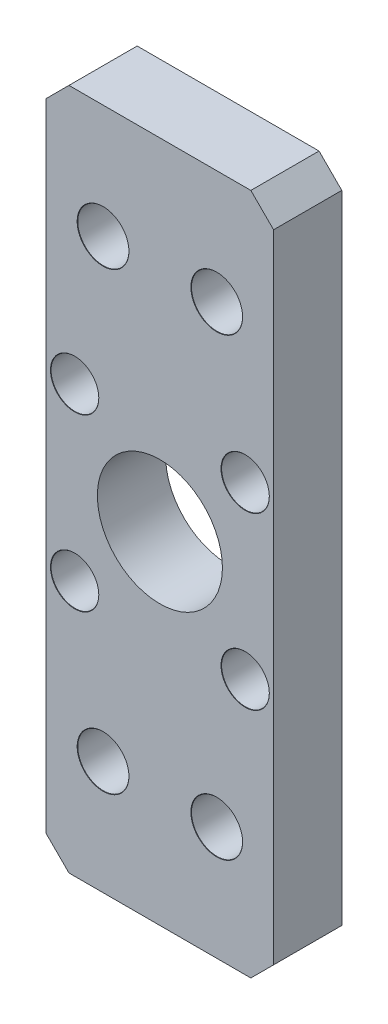
from build123d import *

# Parameters (mm, degrees)
SKETCH_1_W                        = 20
SKETCH_1_H                        = 60
EXTRUDE_1_DEPTH                   = 6
HOLE_WIZARD_4_5_4_5_1_D           = 4.5
HOLE_WIZARD_4_5_4_5_1_CSINK_D     = 4.55
HOLE_WIZARD_4_5_4_5_1_CSINK_ANGLE = 90
SKETCH_4_R                        = 5.5
CUT_EXTRUDE_1_DEPTH               = 6
HOLE_WIZARD_4_2_4_2_1_D           = 4.2
HOLE_WIZARD_4_2_4_2_1_CSINK_D     = 4.25
HOLE_WIZARD_4_2_4_2_1_CSINK_ANGLE = 90
CHAMFER_1_SIZE                    = 2


with BuildPart() as part:
    # 草图1 → 凸台-拉伸1 (new body)
    with BuildSketch(Plane.XY):
        Rectangle(SKETCH_1_W, SKETCH_1_H)
    extrude(amount=EXTRUDE_1_DEPTH)

    # Ø4.5 (4.5) 直径孔1 (through all)
    with Locations(Plane(origin=(-5, 20, 6), x_dir=(1, 0, 0), z_dir=(0, 0, 1))):
        with Locations((0, 0), (10, 0)):
            hole_wizard_4_5_4_5_1 = CounterSinkHole(HOLE_WIZARD_4_5_4_5_1_D / 2, HOLE_WIZARD_4_5_4_5_1_CSINK_D / 2, counter_sink_angle=HOLE_WIZARD_4_5_4_5_1_CSINK_ANGLE)

    # 镜向1: Ø4.5 (4.5) 直径孔1 across plane
    add(hole_wizard_4_5_4_5_1.mirror(Plane.ZX), mode=Mode.SUBTRACT)

    # 草图4 → 切除-拉伸1 (cut)
    with BuildSketch(Plane.XY.offset(6)):
        Circle(SKETCH_4_R)
    extrude(amount=-CUT_EXTRUDE_1_DEPTH, mode=Mode.SUBTRACT)

    # Ø4.2 (4.2) 直径孔1 (through all)
    with Locations(Plane(origin=(-7.5, 7.5, 6), x_dir=(1, 0, 0), z_dir=(0, 0, 1))):
        with Locations((0, 0), (15, 0), (15, -15), (0, -15)):
            CounterSinkHole(HOLE_WIZARD_4_2_4_2_1_D / 2, HOLE_WIZARD_4_2_4_2_1_CSINK_D / 2, counter_sink_angle=HOLE_WIZARD_4_2_4_2_1_CSINK_ANGLE)

    # 倒角1
    chamfer_1_edges = [part.edges().sort_by_distance(p)[0] for p in [
        (10, -30, 3),
        (-10, -30, 3),
        (-10, 30, 3),
        (10, 30, 3),
    ]]
    chamfer(chamfer_1_edges, length=CHAMFER_1_SIZE)


solid = part.part
